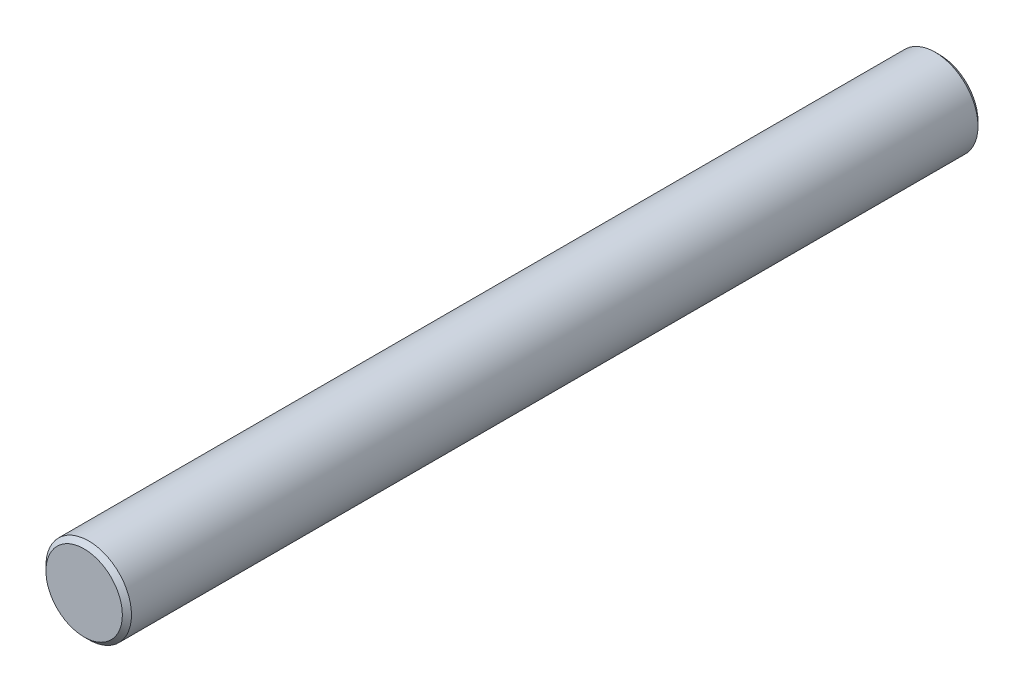
from build123d import *

# Parameters (mm, degrees)
SKETCH1_R           = 4.7625
BOSS_EXTRUDE1_DEPTH = 95.25
CHAMFER1_SIZE       = 0.508


with BuildPart() as part:
    # Sketch1 → Boss-Extrude1 (new body)
    with BuildSketch(Plane.XY):
        Circle(SKETCH1_R)
    extrude(amount=BOSS_EXTRUDE1_DEPTH)

    # Chamfer1
    chamfer1_edges = [part.edges().sort_by_distance(p)[0] for p in [
        (-4.7625, 0, 0),
        (-4.7625, 0, 95.25),
    ]]
    chamfer(chamfer1_edges, length=CHAMFER1_SIZE)


solid = part.part
